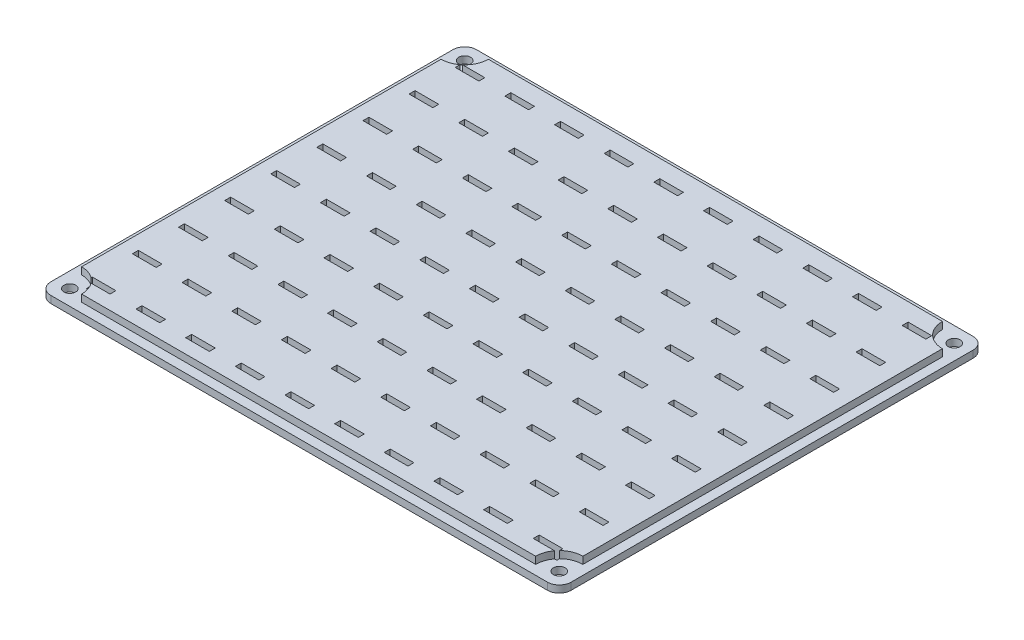
from build123d import *

# Parameters (mm, degrees)
SKETCH1_W           = 220
SKETCH1_H           = 180
BOSS_EXTRUDE1_DEPTH = 3
FILLET1_R           = 5
BOSS_EXTRUDE2_DEPTH = 3
SKETCH8_R           = 2.5
CUT_EXTRUDE3_DEPTH  = 285.269238575
SKETCH9_W           = 10
SKETCH9_H           = 2.5
CUT_EXTRUDE4_DEPTH  = 285.316724798


with BuildPart() as part:
    # Sketch1 → Boss-Extrude1 (new body)
    with BuildSketch(Plane(origin=(0, 0, 0), x_dir=(1, 0, 0), z_dir=(0, 1, 0))):
        with Locations((110, 90)):
            Rectangle(SKETCH1_W, SKETCH1_H)
    extrude(amount=BOSS_EXTRUDE1_DEPTH)

    # Fillet1
    fillet1_edges = [part.edges().sort_by_distance(p)[0] for p in [
        (0, 1.5, -180),
        (220, 1.5, -180),
        (220, 1.5, 0),
        (0, 1.5, 0),
    ]]
    fillet(fillet1_edges, radius=FILLET1_R)

    # Sketch7 → Boss-Extrude2 (add)
    with BuildSketch(Plane(origin=(0, 3, 0), x_dir=(1, 0, 0), z_dir=(0, 1, 0))):
        with BuildLine():
            Line((206, 176), (14, 176))
            ThreePointArc((14, 176), (11.071067812, 168.928932188), (4, 166))
            Line((4, 166), (4, 14))
            ThreePointArc((4, 14), (11.071067812, 11.071067812), (14, 4))
            Line((14, 4), (206, 4))
            ThreePointArc((206, 4), (208.928932188, 11.071067812), (216, 14))
            Line((216, 14), (216, 166))
            ThreePointArc((216, 166), (208.928932188, 168.928932188), (206, 176))
        make_face()
    extrude(amount=BOSS_EXTRUDE2_DEPTH)

    # Sketch8 → Cut-Extrude3 (cut, through all)
    with BuildSketch(Plane(origin=(0, 3, 0), x_dir=(1, 0, 0), z_dir=(0, 1, 0))):
        with Locations(Location((6.5, 173.5, 0), (0, 0, 270))):
            Circle(SKETCH8_R)
        with Locations(Location((213.5, 173.5, 0), (0, 0, 90))):
            Circle(SKETCH8_R)
        with Locations(Location((213.5, 6.5, 0), (0, 0, 270))):
            Circle(SKETCH8_R)
        with Locations(Location((6.5, 6.5, 0), (0, 0, 90))):
            Circle(SKETCH8_R)
    extrude(amount=-CUT_EXTRUDE3_DEPTH, mode=Mode.SUBTRACT)

    # Sketch9 → Cut-Extrude4 (cut, through all)
    with BuildSketch(Plane.XZ):
        with Locations((36, -11.25)):
            Rectangle(SKETCH9_W, SKETCH9_H)
        with Locations((15, -11.25)):
            Rectangle(SKETCH9_W, SKETCH9_H)
        with Locations((57, -11.25)):
            Rectangle(SKETCH9_W, SKETCH9_H)
        with Locations((78, -11.25)):
            Rectangle(SKETCH9_W, SKETCH9_H)
        with Locations((99, -11.25)):
            Rectangle(SKETCH9_W, SKETCH9_H)
        with Locations((120, -11.25)):
            Rectangle(SKETCH9_W, SKETCH9_H)
        with Locations((141, -11.25)):
            Rectangle(SKETCH9_W, SKETCH9_H)
        with Locations((162, -11.25)):
            Rectangle(SKETCH9_W, SKETCH9_H)
        with Locations((183, -11.25)):
            Rectangle(SKETCH9_W, SKETCH9_H)
        with Locations((204, -11.25)):
            Rectangle(SKETCH9_W, SKETCH9_H)
        with Locations((36, -30.75)):
            Rectangle(SKETCH9_W, SKETCH9_H)
        with Locations((57, -30.75)):
            Rectangle(SKETCH9_W, SKETCH9_H)
        with Locations((78, -30.75)):
            Rectangle(SKETCH9_W, SKETCH9_H)
        with Locations((99, -30.75)):
            Rectangle(SKETCH9_W, SKETCH9_H)
        with Locations((120, -30.75)):
            Rectangle(SKETCH9_W, SKETCH9_H)
        with Locations((141, -30.75)):
            Rectangle(SKETCH9_W, SKETCH9_H)
        with Locations((162, -30.75)):
            Rectangle(SKETCH9_W, SKETCH9_H)
        with Locations((183, -30.75)):
            Rectangle(SKETCH9_W, SKETCH9_H)
        with Locations((204, -30.75)):
            Rectangle(SKETCH9_W, SKETCH9_H)
        with Locations((36, -50.25)):
            Rectangle(SKETCH9_W, SKETCH9_H)
        with Locations((57, -50.25)):
            Rectangle(SKETCH9_W, SKETCH9_H)
        with Locations((78, -50.25)):
            Rectangle(SKETCH9_W, SKETCH9_H)
        with Locations((99, -50.25)):
            Rectangle(SKETCH9_W, SKETCH9_H)
        with Locations((120, -50.25)):
            Rectangle(SKETCH9_W, SKETCH9_H)
        with Locations((141, -50.25)):
            Rectangle(SKETCH9_W, SKETCH9_H)
        with Locations((162, -50.25)):
            Rectangle(SKETCH9_W, SKETCH9_H)
        with Locations((183, -50.25)):
            Rectangle(SKETCH9_W, SKETCH9_H)
        with Locations((204, -50.25)):
            Rectangle(SKETCH9_W, SKETCH9_H)
        with Locations((36, -69.75)):
            Rectangle(SKETCH9_W, SKETCH9_H)
        with Locations((57, -69.75)):
            Rectangle(SKETCH9_W, SKETCH9_H)
        with Locations((78, -69.75)):
            Rectangle(SKETCH9_W, SKETCH9_H)
        with Locations((99, -69.75)):
            Rectangle(SKETCH9_W, SKETCH9_H)
        with Locations((120, -69.75)):
            Rectangle(SKETCH9_W, SKETCH9_H)
        with Locations((141, -69.75)):
            Rectangle(SKETCH9_W, SKETCH9_H)
        with Locations((162, -69.75)):
            Rectangle(SKETCH9_W, SKETCH9_H)
        with Locations((183, -69.75)):
            Rectangle(SKETCH9_W, SKETCH9_H)
        with Locations((204, -69.75)):
            Rectangle(SKETCH9_W, SKETCH9_H)
        with Locations((36, -89.25)):
            Rectangle(SKETCH9_W, SKETCH9_H)
        with Locations((57, -89.25)):
            Rectangle(SKETCH9_W, SKETCH9_H)
        with Locations((78, -89.25)):
            Rectangle(SKETCH9_W, SKETCH9_H)
        with Locations((99, -89.25)):
            Rectangle(SKETCH9_W, SKETCH9_H)
        with Locations((120, -89.25)):
            Rectangle(SKETCH9_W, SKETCH9_H)
        with Locations((141, -89.25)):
            Rectangle(SKETCH9_W, SKETCH9_H)
        with Locations((162, -89.25)):
            Rectangle(SKETCH9_W, SKETCH9_H)
        with Locations((183, -89.25)):
            Rectangle(SKETCH9_W, SKETCH9_H)
        with Locations((204, -89.25)):
            Rectangle(SKETCH9_W, SKETCH9_H)
        with Locations((36, -108.75)):
            Rectangle(SKETCH9_W, SKETCH9_H)
        with Locations((57, -108.75)):
            Rectangle(SKETCH9_W, SKETCH9_H)
        with Locations((78, -108.75)):
            Rectangle(SKETCH9_W, SKETCH9_H)
        with Locations((99, -108.75)):
            Rectangle(SKETCH9_W, SKETCH9_H)
        with Locations((120, -108.75)):
            Rectangle(SKETCH9_W, SKETCH9_H)
        with Locations((141, -108.75)):
            Rectangle(SKETCH9_W, SKETCH9_H)
        with Locations((162, -108.75)):
            Rectangle(SKETCH9_W, SKETCH9_H)
        with Locations((183, -108.75)):
            Rectangle(SKETCH9_W, SKETCH9_H)
        with Locations((204, -108.75)):
            Rectangle(SKETCH9_W, SKETCH9_H)
        with Locations((36, -128.25)):
            Rectangle(SKETCH9_W, SKETCH9_H)
        with Locations((57, -128.25)):
            Rectangle(SKETCH9_W, SKETCH9_H)
        with Locations((78, -128.25)):
            Rectangle(SKETCH9_W, SKETCH9_H)
        with Locations((99, -128.25)):
            Rectangle(SKETCH9_W, SKETCH9_H)
        with Locations((120, -128.25)):
            Rectangle(SKETCH9_W, SKETCH9_H)
        with Locations((141, -128.25)):
            Rectangle(SKETCH9_W, SKETCH9_H)
        with Locations((162, -128.25)):
            Rectangle(SKETCH9_W, SKETCH9_H)
        with Locations((183, -128.25)):
            Rectangle(SKETCH9_W, SKETCH9_H)
        with Locations((204, -128.25)):
            Rectangle(SKETCH9_W, SKETCH9_H)
        with Locations((36, -147.75)):
            Rectangle(SKETCH9_W, SKETCH9_H)
        with Locations((57, -147.75)):
            Rectangle(SKETCH9_W, SKETCH9_H)
        with Locations((78, -147.75)):
            Rectangle(SKETCH9_W, SKETCH9_H)
        with Locations((99, -147.75)):
            Rectangle(SKETCH9_W, SKETCH9_H)
        with Locations((120, -147.75)):
            Rectangle(SKETCH9_W, SKETCH9_H)
        with Locations((141, -147.75)):
            Rectangle(SKETCH9_W, SKETCH9_H)
        with Locations((162, -147.75)):
            Rectangle(SKETCH9_W, SKETCH9_H)
        with Locations((183, -147.75)):
            Rectangle(SKETCH9_W, SKETCH9_H)
        with Locations((204, -147.75)):
            Rectangle(SKETCH9_W, SKETCH9_H)
        with Locations((36, -167.25)):
            Rectangle(SKETCH9_W, SKETCH9_H)
        with Locations((57, -167.25)):
            Rectangle(SKETCH9_W, SKETCH9_H)
        with Locations((78, -167.25)):
            Rectangle(SKETCH9_W, SKETCH9_H)
        with Locations((99, -167.25)):
            Rectangle(SKETCH9_W, SKETCH9_H)
        with Locations((120, -167.25)):
            Rectangle(SKETCH9_W, SKETCH9_H)
        with Locations((141, -167.25)):
            Rectangle(SKETCH9_W, SKETCH9_H)
        with Locations((162, -167.25)):
            Rectangle(SKETCH9_W, SKETCH9_H)
        with Locations((183, -167.25)):
            Rectangle(SKETCH9_W, SKETCH9_H)
        with Locations((204, -167.25)):
            Rectangle(SKETCH9_W, SKETCH9_H)
        with Locations((15, -30.75)):
            Rectangle(SKETCH9_W, SKETCH9_H)
        with Locations((15, -50.25)):
            Rectangle(SKETCH9_W, SKETCH9_H)
        with Locations((15, -69.75)):
            Rectangle(SKETCH9_W, SKETCH9_H)
        with Locations((15, -89.25)):
            Rectangle(SKETCH9_W, SKETCH9_H)
        with Locations((15, -108.75)):
            Rectangle(SKETCH9_W, SKETCH9_H)
        with Locations((15, -128.25)):
            Rectangle(SKETCH9_W, SKETCH9_H)
        with Locations((15, -147.75)):
            Rectangle(SKETCH9_W, SKETCH9_H)
        with Locations((15, -167.25)):
            Rectangle(SKETCH9_W, SKETCH9_H)
    extrude(amount=-CUT_EXTRUDE4_DEPTH, mode=Mode.SUBTRACT)


solid = part.part
